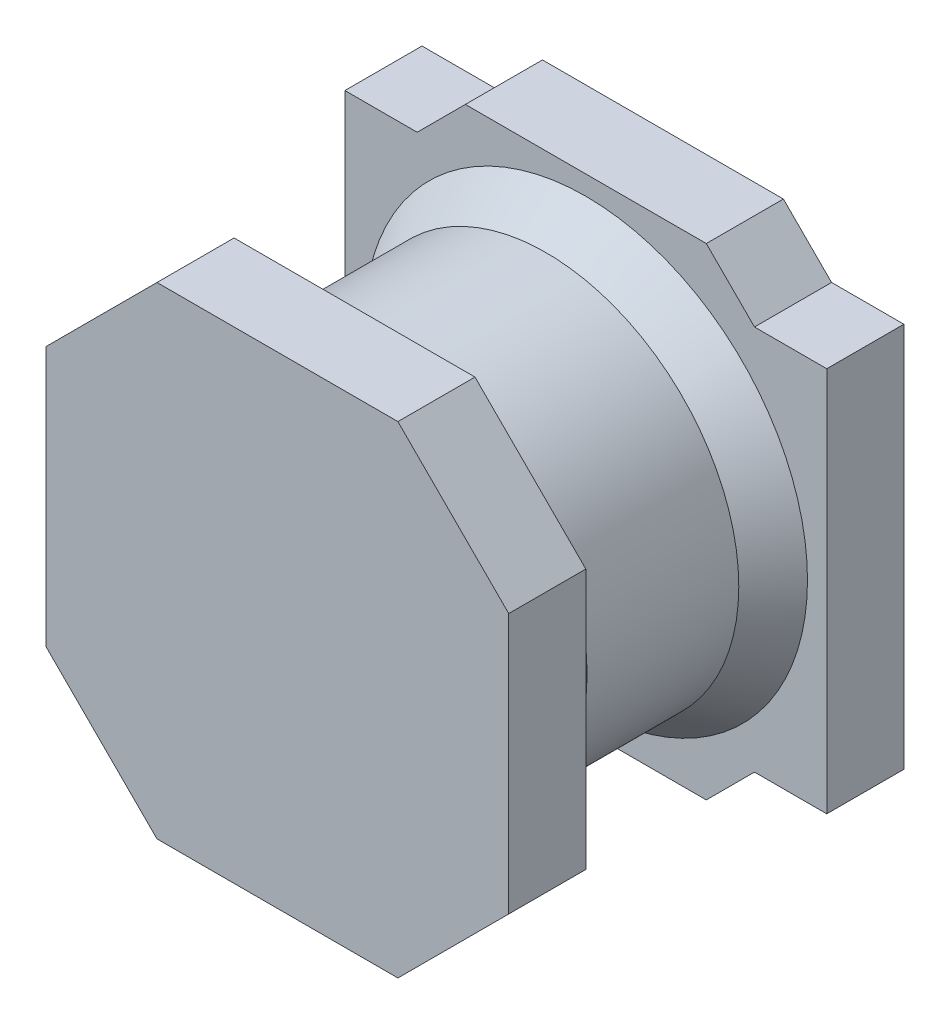
from build123d import *

# Parameters (mm, degrees)
BOSS_EXTRUDE1_DEPTH = 0.8
BOSS_EXTRUDE2_DEPTH = 0.8


with BuildPart() as part:
    # Sketch1 → Boss-Extrude1 (new body)
    with BuildSketch(Plane.XY):
        Polygon((-1.25, 2.5), (1.25, 2.5), (1.75, 2), (2.5, 2), (2.5, -2), (1.75, -2), (1.25, -2.5), (-1.25, -2.5), (-1.75, -2), (-2.5, -2), (-2.5, 2), (-1.75, 2), align=None)
    extrude(amount=BOSS_EXTRUDE1_DEPTH)

    # Sketch2 → Revolve1 (revolve)
    with BuildSketch(Plane(origin=(0, 0, 0), x_dir=(1, 0, 0), z_dir=(0, 1, 0)), mode=Mode.PRIVATE) as revolve1_sk:
        Polygon((0, -0.8), (0, -3.2), (2.3, -3.2), (2, -2.787085424), (2, -1.212914576), (2.3, -0.8), align=None)
    revolve(revolve1_sk.sketch.rotate(Axis((0, 0, 0.8), (0, 0, 1)), 180), axis=Axis((0, 0, 0.8), (0, 0, 1)))

    # Sketch3 → Boss-Extrude2 (add)
    with BuildSketch(Plane.XY.offset(3.2)):
        Polygon((-1.25, 2.5), (1.25, 2.5), (2.4, 1.35), (2.4, -1.35), (1.25, -2.5), (-1.25, -2.5), (-2.4, -1.35), (-2.4, 1.35), align=None)
    extrude(amount=BOSS_EXTRUDE2_DEPTH)


solid = part.part
